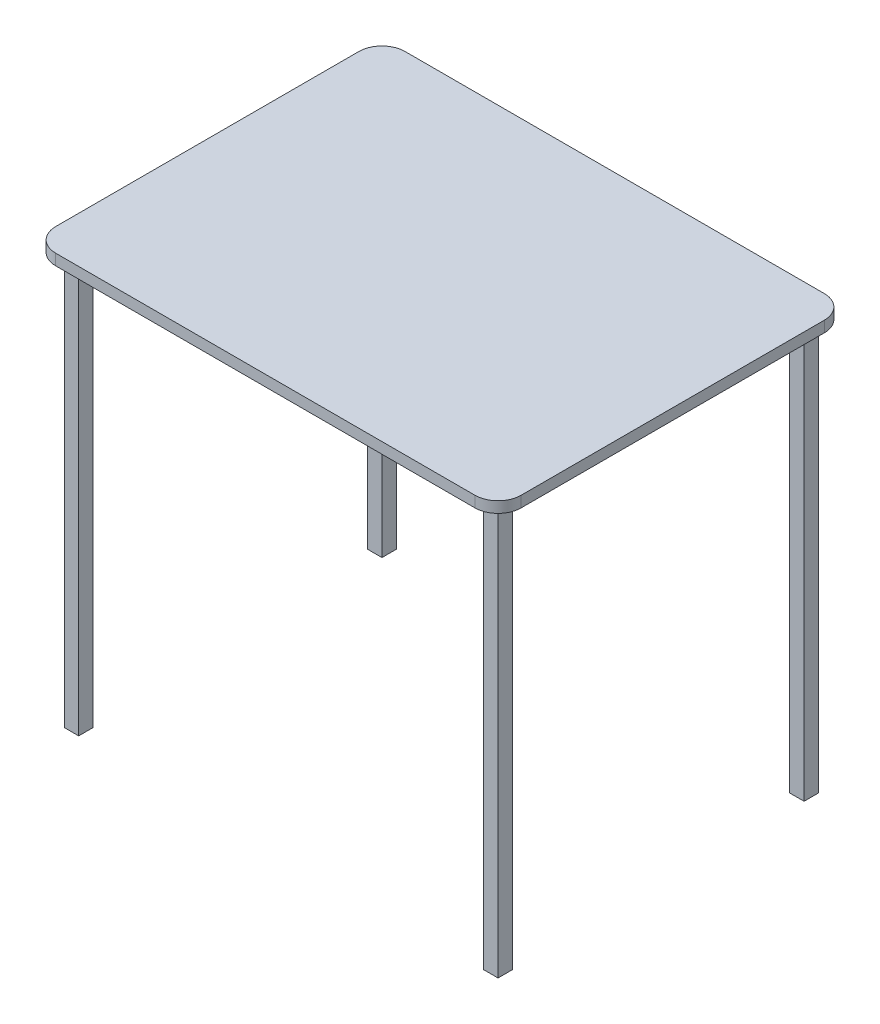
from build123d import *

# Parameters (mm, degrees)
SKETCH2_W           = 806
SKETCH2_H           = 605
BOSS_EXTRUDE1_DEPTH = 19
SKETCH4_W           = 25
SKETCH4_H           = 25
BOSS_EXTRUDE3_DEPTH = 710
FILLET2_R           = 40
FILLET3_R           = 40
FILLET4_R           = 40


with BuildPart() as part:
    # Sketch2 → Boss-Extrude1 (new body)
    with BuildSketch(Plane(origin=(0, 0, 0), x_dir=(1, 0, 0), z_dir=(0, 1, 0))):
        Rectangle(SKETCH2_W, SKETCH2_H)
    extrude(amount=BOSS_EXTRUDE1_DEPTH)

    # Sketch4 → Boss-Extrude3 (add)
    with BuildSketch(Plane.XZ):
        with Locations((-360.678585118, 265)):
            Rectangle(SKETCH4_W, SKETCH4_H)
        with Locations((365.5, 265)):
            Rectangle(SKETCH4_W, SKETCH4_H)
        with Locations((365.5, -265)):
            Rectangle(SKETCH4_W, SKETCH4_H)
        with Locations((-365.5, -265)):
            Rectangle(SKETCH4_W, SKETCH4_H)
    extrude(amount=BOSS_EXTRUDE3_DEPTH)

    # Fillet2
    fillet2_edges = [part.edges().sort_by_distance(p)[0] for p in [
        (403, 9.5, 302.5),
    ]]
    fillet(fillet2_edges, radius=FILLET2_R)

    # Fillet3
    fillet3_edges = [part.edges().sort_by_distance(p)[0] for p in [
        (-403, 9.5, 302.5),
    ]]
    fillet(fillet3_edges, radius=FILLET3_R)

    # Fillet4
    fillet4_edges = [part.edges().sort_by_distance(p)[0] for p in [
        (-403, 9.5, -302.5),
        (403, 9.5, -302.5),
    ]]
    fillet(fillet4_edges, radius=FILLET4_R)


solid = part.part
